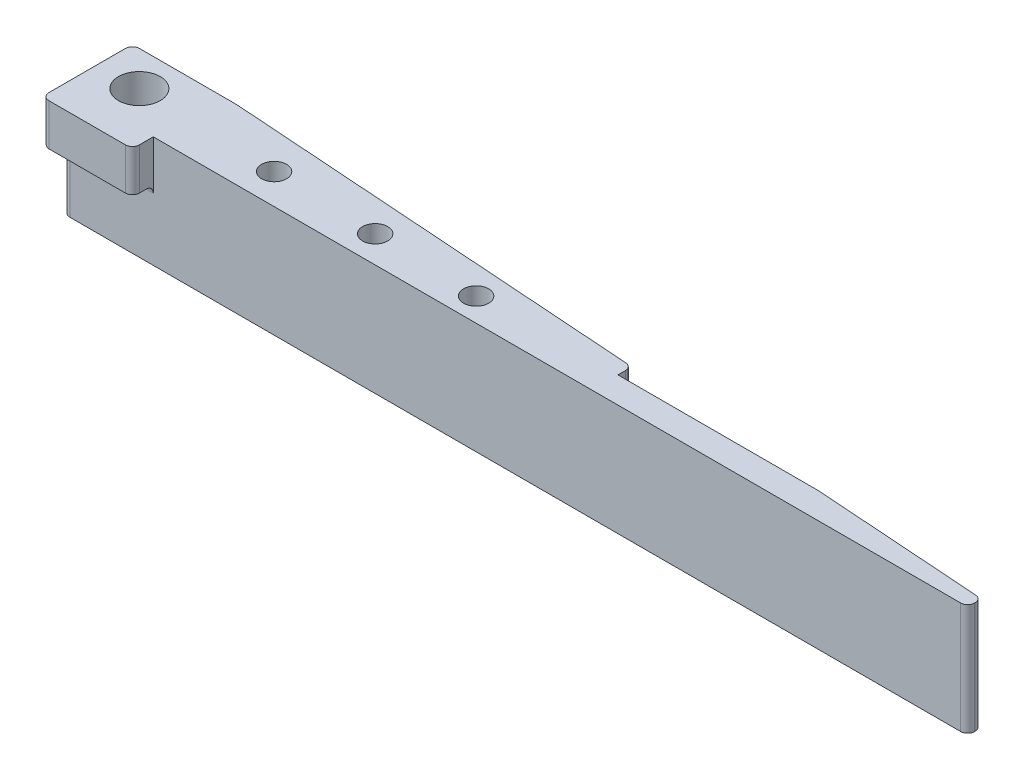
from build123d import *
from build123d.topology import SkipClean

# Parameters (mm, degrees)
SKETCH1_R           = 3.81
SKETCH1_R_2         = 2.286
BOSS_EXTRUDE1_DEPTH = 7.62
BOSS_EXTRUDE2_START = 12.7
SKETCH2_R           = 3.81
BOSS_EXTRUDE2_DEPTH = 12.7
CUT_EXTRUDE1_DEPTH  = 159.912476854
SKETCH5_W           = 16.51
SKETCH5_H           = 3.81
BOSS_EXTRUDE3_DEPTH = 7.62
FILLET2_R           = 1.27
FILLET3_R           = 1.27
FILLET4_R           = 1.27


with BuildPart() as part:
    # Sketch1 → Boss-Extrude1 (new body)
    with BuildSketch(Plane(origin=(0, 0, 0), x_dir=(1, 0, 0), z_dir=(0, 1, 0))):
        Polygon((157.48, -3.81), (11.43, 6.35), (-7.62, 6.35), (-7.62, -6.35), (157.48, -6.35), align=None)
        with Locations(Location((0, 0, 0), (0, 0, 270))):
            Circle(SKETCH1_R, mode=Mode.SUBTRACT)
        with Locations(Location((25.4, -0.819354839, 0), (0, 0, 270))):
            Circle(SKETCH1_R_2, mode=Mode.SUBTRACT)
        with Locations(Location((44.45, -1.433870968, 0), (0, 0, 270))):
            Circle(SKETCH1_R_2, mode=Mode.SUBTRACT)
        with Locations(Location((63.5, -2.048387097, 0), (0, 0, 270))):
            Circle(SKETCH1_R_2, mode=Mode.SUBTRACT)
    extrude(amount=BOSS_EXTRUDE1_DEPTH)

    # Sketch2 → Boss-Extrude2 (add)
    with SkipClean():  # the faces are left unmerged after this step: merging them gives an invalid solid
        with BuildSketch(Plane(origin=(0, 0, 0), x_dir=(-1, 0, 0), z_dir=(0, -1, 0)).offset(BOSS_EXTRUDE2_START)):
            Polygon((-157.48, -6.35), (-157.48, -3.81), (-11.43, 6.35), (7.62, 6.35), (7.62, -6.35), align=None)
            with Locations(Location((0, 0, 0), (0, 0, 90))):
                Circle(SKETCH2_R, mode=Mode.SUBTRACT)
            Polygon((-27.306410589, -4.121354839), (-23.493589411, -4.121354839), (-21.587178822, -0.819354839), (-23.493589411, 2.482645161), (-27.306410589, 2.482645161), (-29.212821178, -0.819354839), align=None, mode=Mode.SUBTRACT)
            Polygon((-40.637178822, -1.433870968), (-42.543589411, 1.868129032), (-46.356410589, 1.868129032), (-48.262821178, -1.433870968), (-46.356410589, -4.735870968), (-42.543589411, -4.735870968), align=None, mode=Mode.SUBTRACT)
            Polygon((-59.687178822, -2.048387097), (-61.593589411, 1.253612903), (-65.406410589, 1.253612903), (-67.312821178, -2.048387097), (-65.406410589, -5.350387097), (-61.593589411, -5.350387097), align=None, mode=Mode.SUBTRACT)
        extrude(amount=-BOSS_EXTRUDE2_DEPTH)

    # Sketch4 → Cut-Extrude1 (cut, through all)
    with SkipClean():  # the faces are left unmerged after this step: merging them gives an invalid solid
        with BuildSketch(Plane(origin=(0, 7.62, 0), x_dir=(1, 0, 0), z_dir=(0, 1, 0))):
            Polygon((88.9, 0.960782609), (88.9, -1.579217391), (125.4125, -1.579217391), align=None)
        extrude(amount=-CUT_EXTRUDE1_DEPTH, mode=Mode.SUBTRACT)

    # Sketch5 → Boss-Extrude3 (add)
    with SkipClean():  # the faces are left unmerged after this step: merging them gives an invalid solid
        with BuildSketch(Plane.XZ):
            with Locations((0.635, 8.255)):
                Rectangle(SKETCH5_W, SKETCH5_H)
        extrude(amount=-BOSS_EXTRUDE3_DEPTH)

    # Fillet2
    fillet2_edges = [part.edges().sort_by_distance(p)[0] for p in [
        (88.9, -6.35, -0.960782609),
        (0.635, 0, 6.35),
        (8.89, 3.81, 10.16),
        (157.48, -6.35, 3.81),
        (157.48, -6.35, 6.35),
    ]]
    fillet(fillet2_edges, radius=FILLET2_R)

    # Fillet3
    fillet3_edges = [part.edges().sort_by_distance(p)[0] for p in [
        (-7.62, -6.35, -6.35),
    ]]
    fillet(fillet3_edges, radius=FILLET3_R)

    # Fillet4
    fillet4_edges = [part.edges().sort_by_distance(p)[0] for p in [
        (-7.62, 0, 8.89),
        (-7.62, 3.81, 10.16),
        (-7.62, -6.985, 6.35),
        (-7.62, -0.371974388, 6.721974388),
    ]]
    fillet(fillet4_edges, radius=FILLET4_R)


solid = part.part
